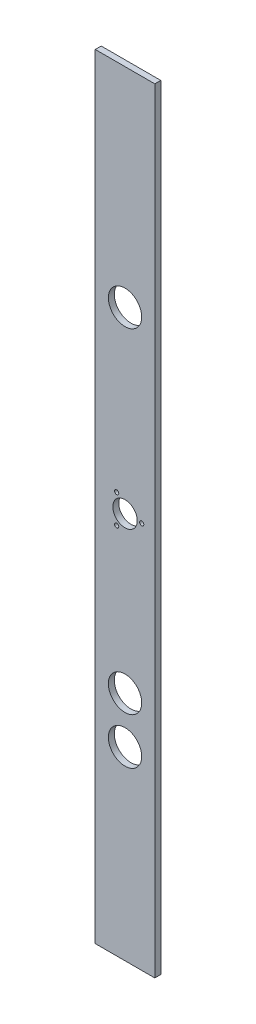
from build123d import *

# Parameters (mm, degrees)
ESQUISSE1_W        = 50
ESQUISSE1_H        = 650
ESQUISSE1_R        = 10.25
ESQUISSE1_R_2      = 14
ESQUISSE1_R_3      = 1.75
BOSS_EXTRU_1_DEPTH = 5
CHANFREIN1_SIZE    = 1


with BuildPart() as part:
    # Esquisse1 → Boss.-Extru.1 (new body)
    with BuildSketch(Plane.XY):
        with Locations((25, -325)):
            Rectangle(ESQUISSE1_W, ESQUISSE1_H)
        with Locations((25, -325)):
            Circle(ESQUISSE1_R, mode=Mode.SUBTRACT)
        with Locations((25, -494.5)):
            Circle(ESQUISSE1_R_2, mode=Mode.SUBTRACT)
        with Locations((18, -312.875644347)):
            Circle(ESQUISSE1_R_3, mode=Mode.SUBTRACT)
        with Locations((18, -337.124355653)):
            Circle(ESQUISSE1_R_3, mode=Mode.SUBTRACT)
        with Locations((39, -325)):
            Circle(ESQUISSE1_R_3, mode=Mode.SUBTRACT)
        with Locations((25, -455.5)):
            Circle(ESQUISSE1_R_2, mode=Mode.SUBTRACT)
        with Locations((25, -175)):
            Circle(ESQUISSE1_R_2, mode=Mode.SUBTRACT)
    extrude(amount=BOSS_EXTRU_1_DEPTH)

    # Chanfrein1
    chanfrein1_edges = [part.edges().sort_by_distance(p)[0] for p in [
        (16.25, -312.875644347, 0),
        (37.25, -325, 0),
        (16.25, -337.124355653, 0),
    ]]
    chamfer(chanfrein1_edges, length=CHANFREIN1_SIZE)


solid = part.part
